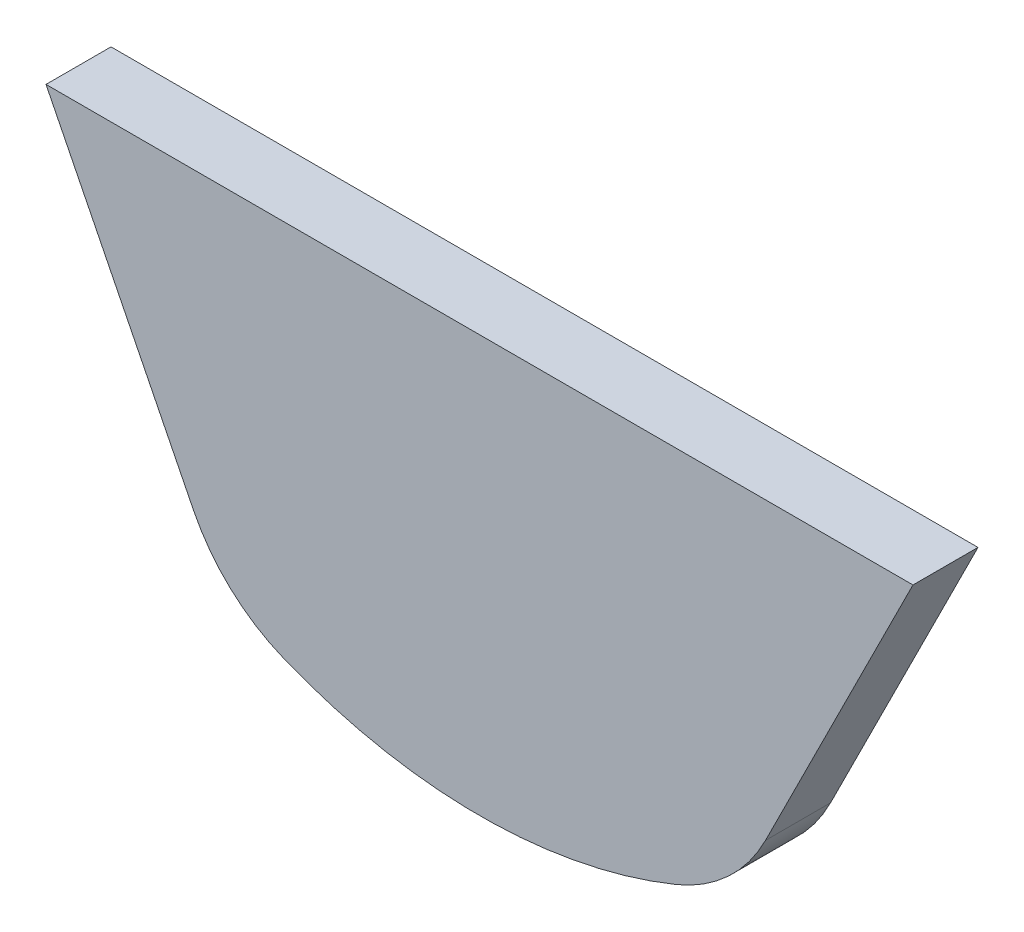
from build123d import *

# Parameters (mm, degrees)
BOSS_EXTRUDE1_DEPTH = 19.05
FILLET1_R           = 50.8


with BuildPart() as part:
    # Sketch1 → Boss-Extrude1 (new body)
    with BuildSketch(Plane.XY):
        with BuildLine():
            Line((-127, 0), (127, 0))
            Line((127, 0), (76.2, -101.6))
            ThreePointArc((76.2, -101.6), (0, -122.017728463), (-76.2, -101.6))
            Line((-76.2, -101.6), (-127, 0))
        make_face()
    extrude(amount=BOSS_EXTRUDE1_DEPTH)

    # Fillet1
    fillet1_edges = [part.edges().sort_by_distance(p)[0] for p in [
        (76.2, -101.6, 9.525),
        (-76.2, -101.6, 9.525),
    ]]
    fillet(fillet1_edges, radius=FILLET1_R)


solid = part.part
